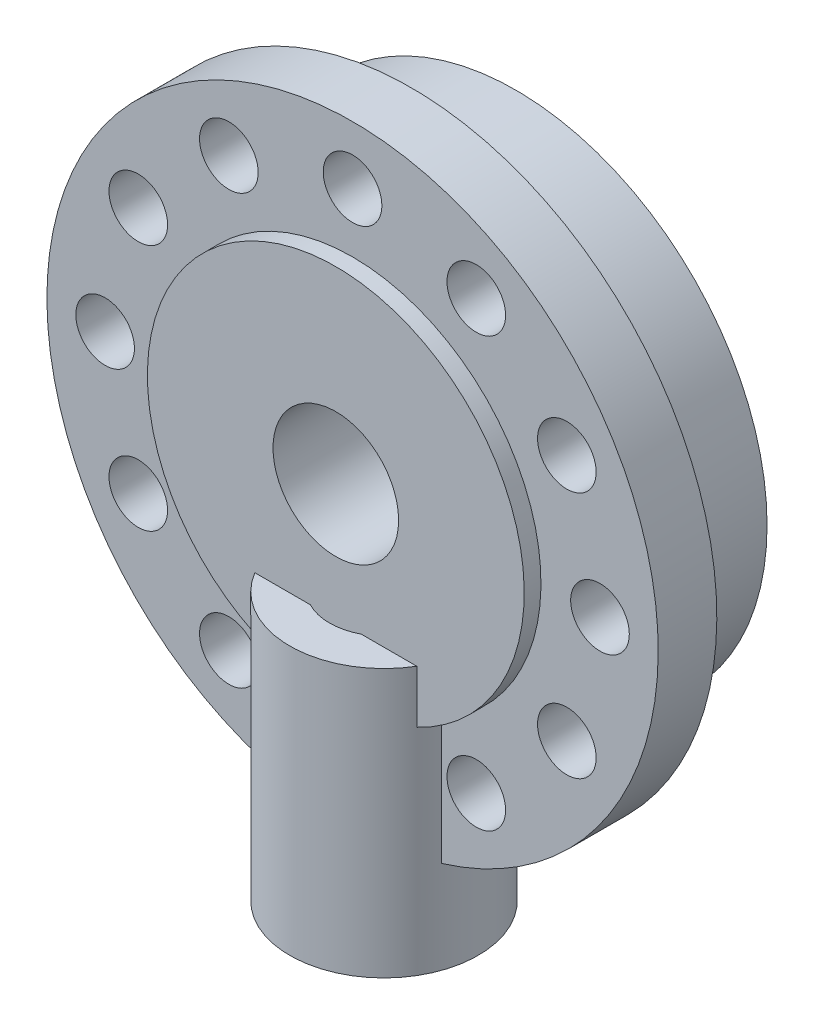
from build123d import *

# Parameters (mm, degrees)
SKETCH1_R                = 60
BOSS_EXTRUDE1_DEPTH      = 25
SKETCH2_R                = 73
BOSS_EXTRUDE2_DEPTH      = 14
SKETCH4_R                = 45
BOSS_EXTRUDE3_DEPTH      = 4
SKETCH5_R                = 15
CUT_EXTRUDE1_DEPTH       = 99
SKETCH6_R                = 7
CUT_EXTRUDE2_DEPTH       = 10
BOSS_EXTRUDE4_DEPTH      = 19
BOSS_EXTRUDE4_DEPTH_BACK = 45
SKETCH7_R                = 22.5
SKETCH7_R_2              = 13


with BuildPart() as part:
    # Sketch1 → Boss-Extrude1 (new body)
    with BuildSketch(Plane.XY):
        Circle(SKETCH1_R)
    extrude(amount=BOSS_EXTRUDE1_DEPTH)

    # Sketch2 → Boss-Extrude2 (add)
    with BuildSketch(Plane.XY.offset(25)):
        with Locations(Location((0, 0, 0), (0, 0, 180))):
            Circle(SKETCH2_R)
    extrude(amount=BOSS_EXTRUDE2_DEPTH)

    # Sketch4 → Boss-Extrude3 (add)
    with BuildSketch(Plane.XY.offset(39)):
        Circle(SKETCH4_R)
    extrude(amount=BOSS_EXTRUDE3_DEPTH)

    # Sketch5 → Cut-Extrude1 (cut)
    with BuildSketch(Plane.XY.offset(43)):
        Circle(SKETCH5_R)
    extrude(amount=-CUT_EXTRUDE1_DEPTH, mode=Mode.SUBTRACT)

    # Sketch6 → Cut-Extrude2 (cut)
    with BuildSketch(Plane.XY.offset(39)):
        with Locations((0, 59.095126961)):
            Circle(SKETCH6_R)
        with Locations((29.54756348, 51.177881188)):
            Circle(SKETCH6_R)
        with Locations((51.177881188, 29.54756348)):
            Circle(SKETCH6_R)
        with Locations((59.095126961, 0)):
            Circle(SKETCH6_R)
        with Locations((51.177881188, -29.54756348)):
            Circle(SKETCH6_R)
        with Locations((29.54756348, -51.177881188)):
            Circle(SKETCH6_R)
        with Locations((-29.54756348, -51.177881188)):
            Circle(SKETCH6_R)
        with Locations((-51.177881188, -29.54756348)):
            Circle(SKETCH6_R)
        with Locations((-59.095126961, 0)):
            Circle(SKETCH6_R)
        with Locations((-51.177881188, 29.54756348)):
            Circle(SKETCH6_R)
        with Locations((-29.54756348, 51.177881188)):
            Circle(SKETCH6_R)
    extrude(amount=-CUT_EXTRUDE2_DEPTH, mode=Mode.SUBTRACT)

    # Sketch7 → Boss-Extrude4 (add, two sides: drawn at the far end of the back side and taken through both)
    with BuildSketch(Plane(origin=(0, -73, 0), x_dir=(-1, 0, 0), z_dir=(0, -1, 0)).offset(-BOSS_EXTRUDE4_DEPTH_BACK)):
        with Locations(Location((0, -31.497185576, 0), (0, 0, 210.74620731))):
            Circle(SKETCH7_R)
        with Locations(Location((0, -31.497185576, 0), (0, 0, 297.769160661))):
            Circle(SKETCH7_R_2, mode=Mode.SUBTRACT)
    extrude(amount=BOSS_EXTRUDE4_DEPTH + BOSS_EXTRUDE4_DEPTH_BACK)


solid = part.part
